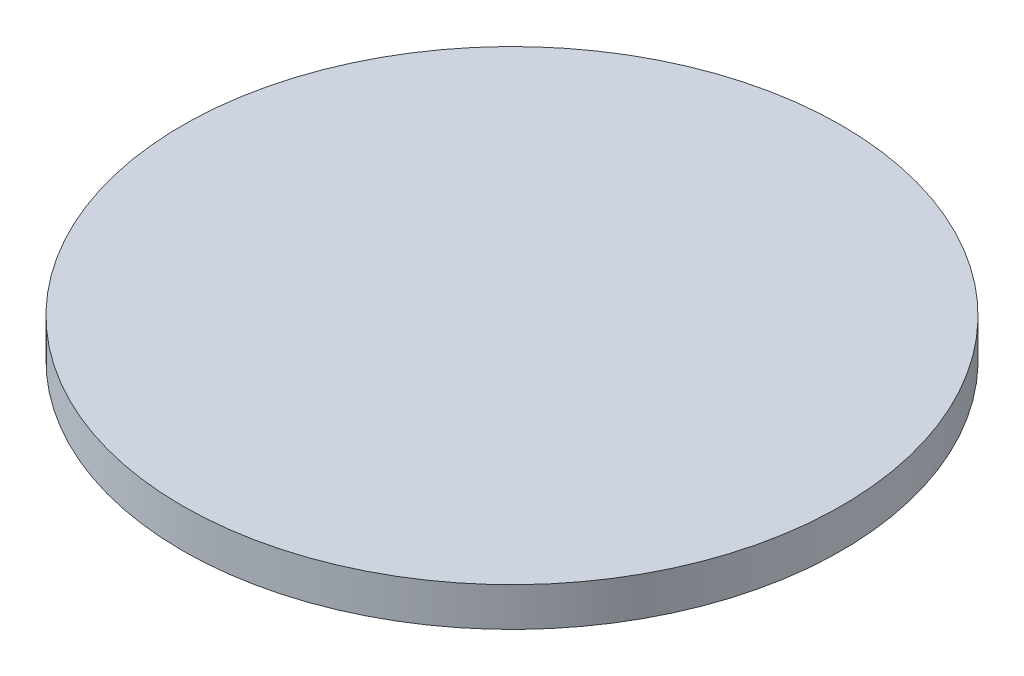
from build123d import *

# Parameters (mm, degrees)
SKETCH1_R           = 17
BOSS_EXTRUDE1_DEPTH = 2


with BuildPart() as part:
    # Sketch1 → Boss-Extrude1 (new body)
    with BuildSketch(Plane(origin=(0, 0, 0), x_dir=(1, 0, 0), z_dir=(0, 1, 0))):
        with Locations(Location((0, 0, 0), (0, 0, 270))):
            Circle(SKETCH1_R)
    extrude(amount=BOSS_EXTRUDE1_DEPTH)


solid = part.part
